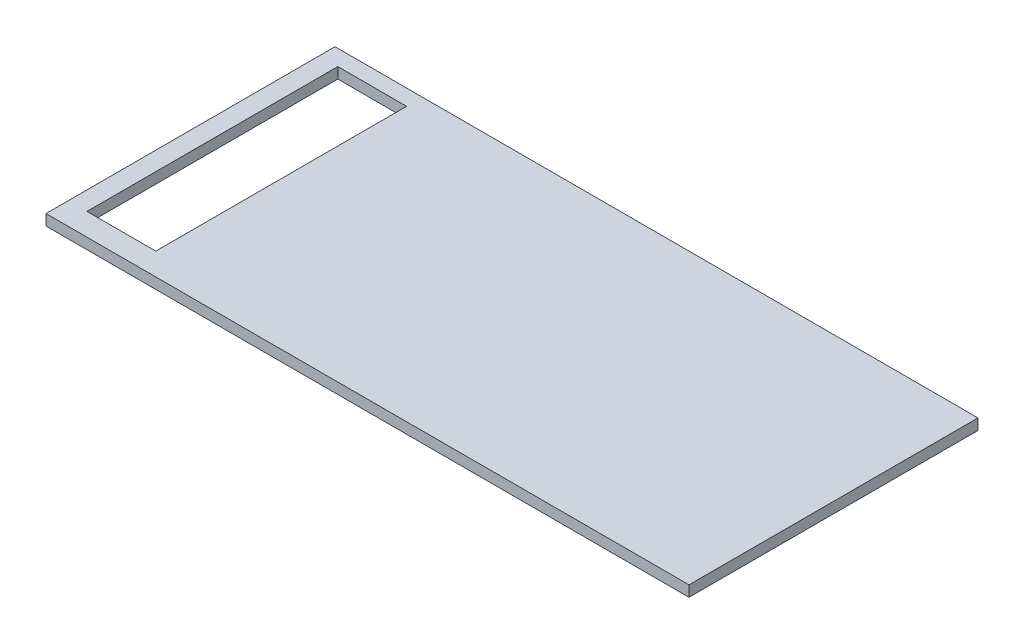
from build123d import *

# Parameters (mm, degrees)
SKETCH1_W           = 89
SKETCH1_H           = 40
BOSS_EXTRUDE1_DEPTH = 1.5
SKETCH2_W           = 9.522327529
SKETCH2_H           = 34.716533419
CUT_EXTRUDE1_DEPTH  = 1.5


with BuildPart() as part:
    # Sketch1 → Boss-Extrude1 (new body)
    with BuildSketch(Plane(origin=(0, 0, 0), x_dir=(1, 0, 0), z_dir=(0, 1, 0))):
        with Locations((44.5, 20)):
            Rectangle(SKETCH1_W, SKETCH1_H)
    extrude(amount=BOSS_EXTRUDE1_DEPTH)

    # Sketch2 → Cut-Extrude1 (cut)
    with BuildSketch(Plane(origin=(0, 1.5, 0), x_dir=(1, 0, 0), z_dir=(0, 1, 0))):
        with Locations((7.337781427, 20.451785599)):
            Rectangle(SKETCH2_W, SKETCH2_H)
    extrude(amount=-CUT_EXTRUDE1_DEPTH, mode=Mode.SUBTRACT)


solid = part.part
